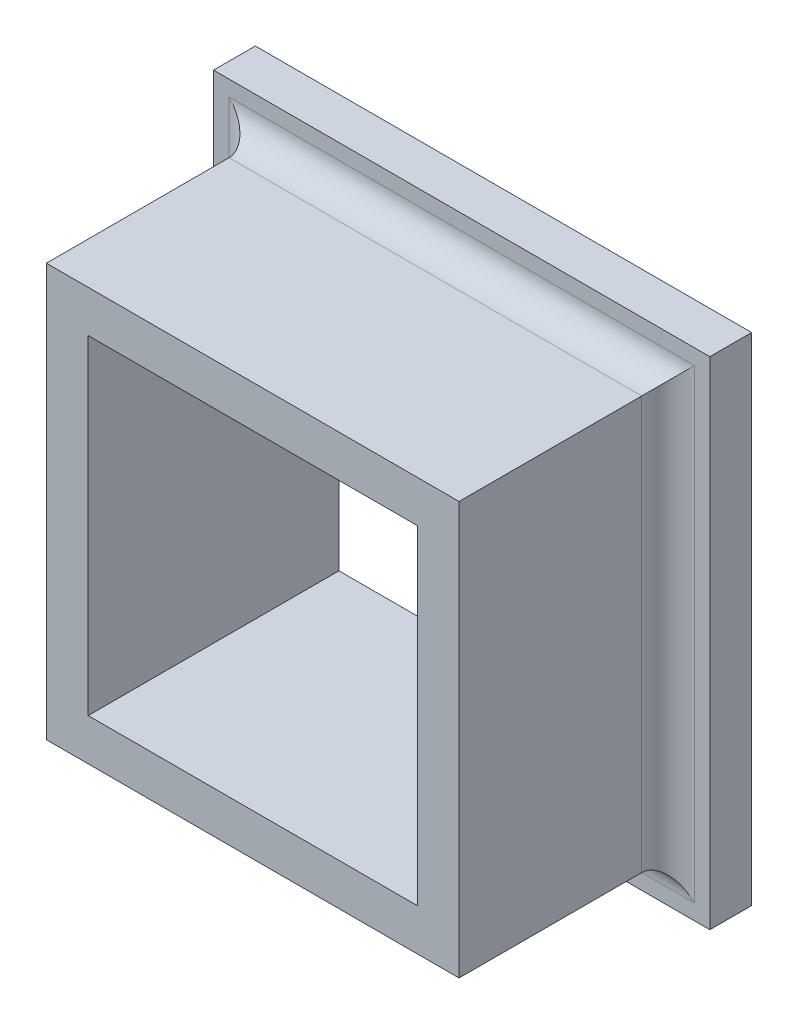
from build123d import *

# Parameters (mm, degrees)
SKETCH1_W           = 15.675
SKETCH1_H           = 15.675
SKETCH1_W_2         = 12.5
SKETCH1_H_2         = 12.5
BOSS_EXTRUDE2_DEPTH = 9.525
SKETCH1_7_W         = 18.85
SKETCH1_7_H         = 18.85
BOSS_EXTRUDE3_DEPTH = 1.5875
SKETCH1_8_W         = 12.5
SKETCH1_8_H         = 12.5
CUT_EXTRUDE3_DEPTH  = 17.636336121
FILLET4_R           = 1


with BuildPart() as part:
    # Sketch1 → Boss-Extrude2 (new body)
    with BuildSketch(Plane.XY):
        with Locations((-0.154958678, -0.284090909)):
            Rectangle(SKETCH1_W, SKETCH1_H)
        with Locations((-0.154958678, -0.284090909)):
            Rectangle(SKETCH1_W_2, SKETCH1_H_2, mode=Mode.SUBTRACT)
    extrude(amount=BOSS_EXTRUDE2_DEPTH)

    # Sketch1<7> → Boss-Extrude3 (add)
    with BuildSketch(Plane.XY):
        with Locations((-0.154958678, -0.284090909)):
            Rectangle(SKETCH1_7_W, SKETCH1_7_H)
    extrude(amount=BOSS_EXTRUDE3_DEPTH)

    # Sketch1<8> → Cut-Extrude3 (cut, through all)
    with BuildSketch(Plane.XY):
        with Locations((-0.154958678, -0.284090909)):
            Rectangle(SKETCH1_8_W, SKETCH1_8_H)
    extrude(amount=CUT_EXTRUDE3_DEPTH, mode=Mode.SUBTRACT)

    # Fillet4
    fillet4_edges = [part.edges().sort_by_distance(p)[0] for p in [
        (7.682541322, -0.284090909, 1.5875),
        (-0.154958678, 7.553409091, 1.5875),
        (-0.154958678, -8.121590909, 1.5875),
        (-7.992458678, -0.284090909, 1.5875),
    ]]
    fillet(fillet4_edges, radius=FILLET4_R)


solid = part.part
